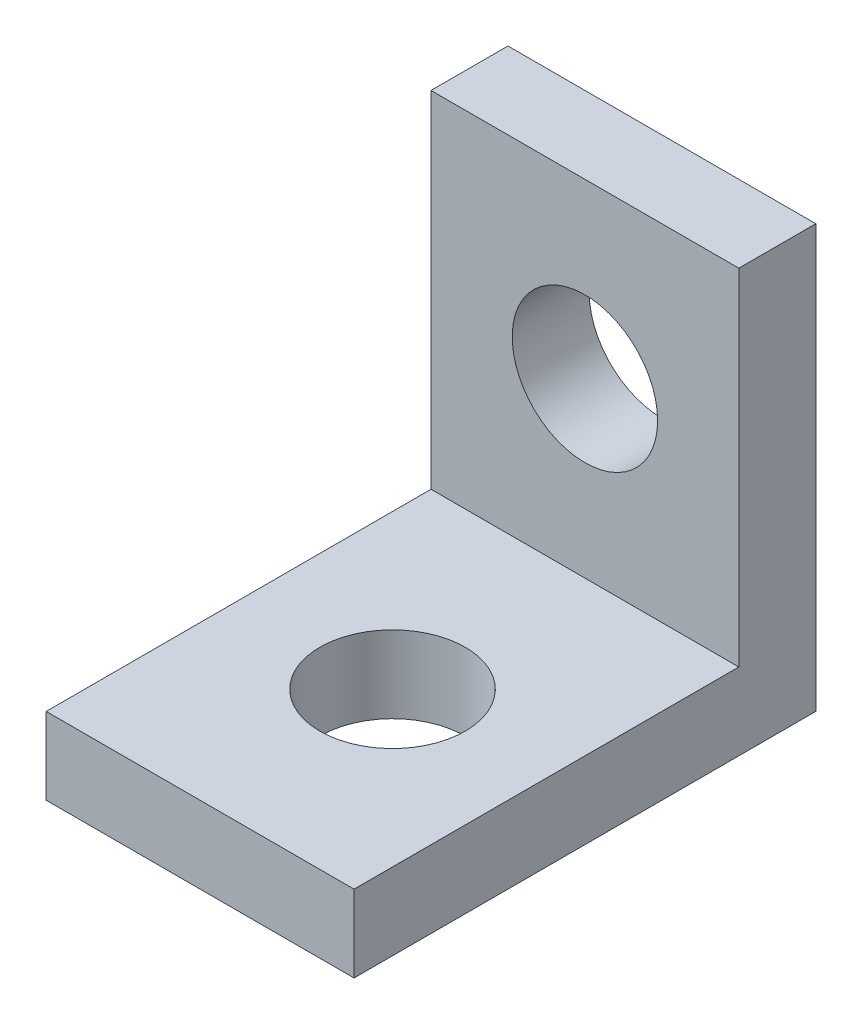
from build123d import *

# Parameters (mm, degrees)
SKETCH1_W                 = 6.35
SKETCH1_H                 = 9.525
BOSS_EXTRUDE1_DEPTH       = 1.5875
SKETCH2_W                 = 6.35
SKETCH2_H                 = 1.5875
BOSS_EXTRUDE2_DEPTH       = 7.1247
F_3_0MM_DOWEL_HOLE1_D     = 3
F_3_0MM_DOWEL_HOLE2_D     = 3
F_3_0MM_DOWEL_HOLE2_DEPTH = 6.35
F_3_0MM_DOWEL_HOLE2_TIP   = 0.901290929


with BuildPart() as part:
    # Sketch1 → Boss-Extrude1 (new body)
    with BuildSketch(Plane(origin=(0, 0, 0), x_dir=(1, 0, 0), z_dir=(0, 1, 0))):
        Rectangle(SKETCH1_W, SKETCH1_H)
    extrude(amount=BOSS_EXTRUDE1_DEPTH)

    # Sketch2 → Boss-Extrude2 (add)
    with BuildSketch(Plane(origin=(0, 1.5875, 0), x_dir=(1, 0, 0), z_dir=(0, 1, 0))):
        with Locations((0, 3.96875)):
            Rectangle(SKETCH2_W, SKETCH2_H)
    extrude(amount=BOSS_EXTRUDE2_DEPTH)

    # Ø3.0mm Dowel Hole1 (through all)
    with Locations(Plane(origin=(0, 1.5875, 0), x_dir=(1, 0, 0), z_dir=(0, 1, 0))):
        with Locations((0, -0.79375)):
            Hole(F_3_0MM_DOWEL_HOLE1_D / 2)

    # Ø3.0mm Dowel Hole2
    with Locations(Plane.XY.offset(-3.175)):
        with Locations((0, 5.14985)):
            Hole(F_3_0MM_DOWEL_HOLE2_D / 2, depth=F_3_0MM_DOWEL_HOLE2_DEPTH)
            with Locations((0, 0, -(F_3_0MM_DOWEL_HOLE2_DEPTH + F_3_0MM_DOWEL_HOLE2_TIP / 2))):  # 118° drill point
                Cone(0, F_3_0MM_DOWEL_HOLE2_D / 2, F_3_0MM_DOWEL_HOLE2_TIP, mode=Mode.SUBTRACT)


solid = part.part
